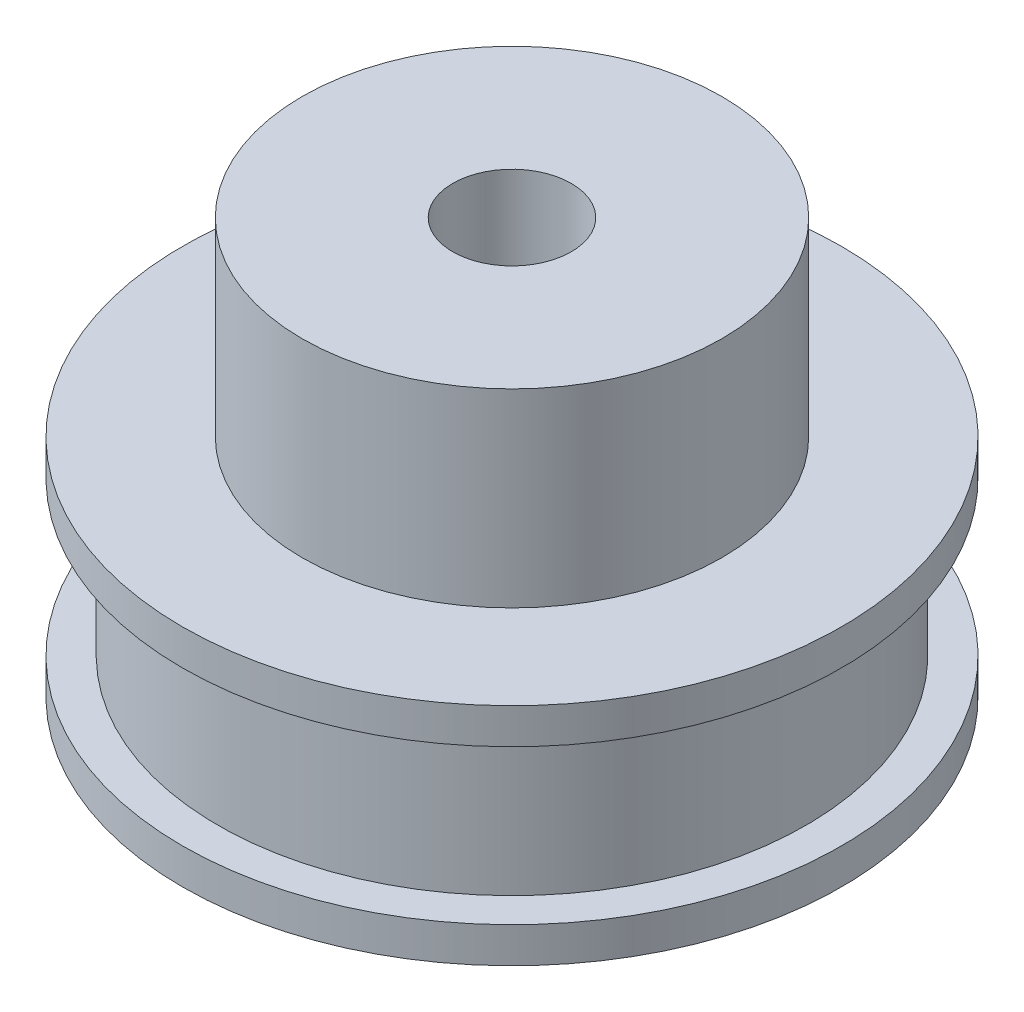
from build123d import *


with BuildPart() as part:
    # Esquisse1 → Révolution1 (revolve)
    with BuildSketch(Plane.XY, mode=Mode.PRIVATE) as r_volution1_sk:
        Polygon((2.5, 0), (13.9, 0), (13.9, 1.5), (12.4, 1.5), (12.4, 8), (13.9, 8), (13.9, 9.5), (8.85, 9.5), (8.85, 17.5), (2.5, 17.5), align=None)
    revolve(r_volution1_sk.sketch.rotate(Axis((0, 0, 0), (0, 1, 0)), 90), axis=Axis((0, 0, 0), (0, 1, 0)))


solid = part.part
